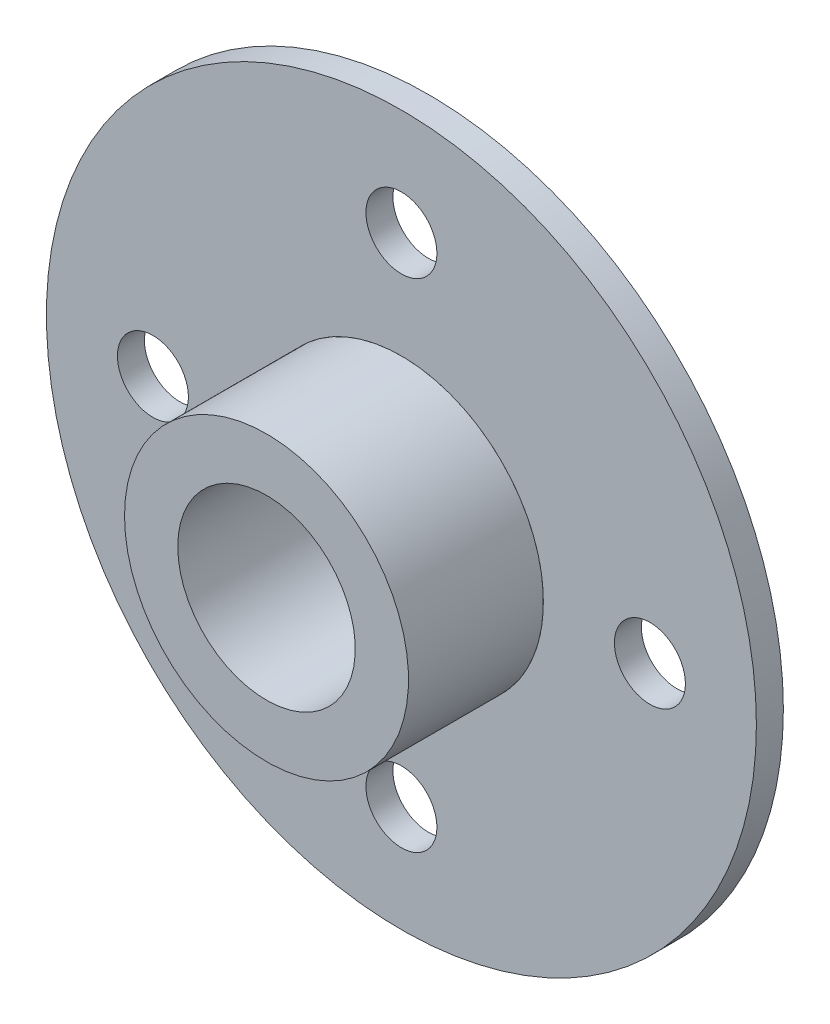
from build123d import *

# Parameters (mm, degrees)
IZIM1_R                     = 10
IZIM1_R_2                   = 4
Y_KSEKLIK_EKSTR_ZYON1_DEPTH = 0.76
IZIM2_R                     = 1
KES_EKSTR_ZYON1_DEPTH       = 0.76
IZIM3_R                     = 4
IZIM3_R_2                   = 2.5
Y_KSEKLIK_EKSTR_ZYON2_DEPTH = 3.8


with BuildPart() as part:
    # Çizim1 → Yükseklik-Ekstrüzyon1 (new body)
    with BuildSketch(Plane.XY):
        Circle(IZIM1_R)
        Circle(IZIM1_R_2, mode=Mode.SUBTRACT)
    extrude(amount=Y_KSEKLIK_EKSTR_ZYON1_DEPTH)

    # Çizim2 → Kes-Ekstrüzyon1 (cut)
    with BuildSketch(Plane.XY.offset(0.76)):
        with Locations((-7, 0)):
            Circle(IZIM2_R)
        with Locations((0, 7)):
            Circle(IZIM2_R)
        with Locations((7, 0)):
            Circle(IZIM2_R)
        with Locations((0, -7)):
            Circle(IZIM2_R)
    extrude(amount=-KES_EKSTR_ZYON1_DEPTH, mode=Mode.SUBTRACT)


with BuildPart() as body_2:
    # Çizim3 → Yükseklik-Ekstrüzyon2 (new body)
    with BuildSketch(Plane.XY.offset(0.76)):
        with Locations(Location((0, 0, 0), (0, 0, 180))):
            Circle(IZIM3_R)
        with Locations(Location((0, 0, 0), (0, 0, 180))):
            Circle(IZIM3_R_2, mode=Mode.SUBTRACT)
    extrude(amount=Y_KSEKLIK_EKSTR_ZYON2_DEPTH)


solid = Compound([part.part, body_2.part])
